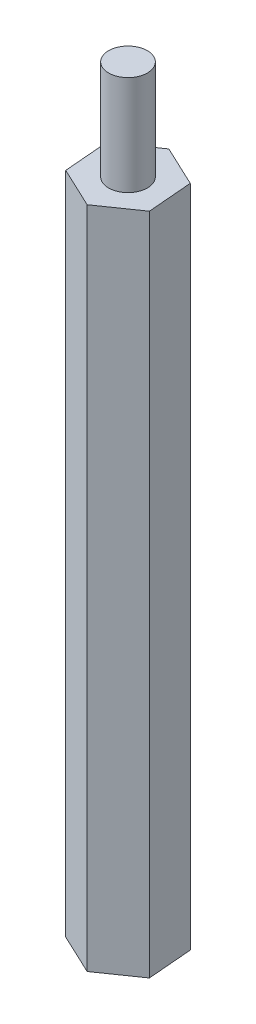
from build123d import *

# Parameters (mm, degrees)
BOSS_EXTRU_1_DEPTH      = 60
ESQUISSE2_R             = 2
ENL_V_MAT_EXTRU_1_DEPTH = 10
ESQUISSE3_R             = 1.75
BOSS_EXTRU_2_DEPTH      = 9


with BuildPart() as part:
    # Esquisse1 → Boss.-Extru.1 (new body)
    with BuildSketch(Plane(origin=(0, 0, 0), x_dir=(1, 0, 0), z_dir=(0, 1, 0))):
        Polygon((3.655828371, -1.722861646), (3.319956139, 2.304609418), (-0.335872233, 4.027471065), (-3.655828371, 1.722861646), (-3.319956139, -2.304609418), (0.335872233, -4.027471065), align=None)
    extrude(amount=BOSS_EXTRU_1_DEPTH)

    # Esquisse2 → Enlèv. mat.-Extru.1 (cut)
    with BuildSketch(Plane.XZ):
        with Locations(Location((0, 0, 0), (0, 0, 270))):
            Circle(ESQUISSE2_R)
    extrude(amount=-ENL_V_MAT_EXTRU_1_DEPTH, mode=Mode.SUBTRACT)

    # Esquisse3 → Boss.-Extru.2 (add)
    with BuildSketch(Plane(origin=(0, 60, 0), x_dir=(1, 0, 0), z_dir=(0, 1, 0))):
        with Locations(Location((0, 0, 0), (0, 0, 270))):
            Circle(ESQUISSE3_R)
    extrude(amount=BOSS_EXTRU_2_DEPTH)


solid = part.part
